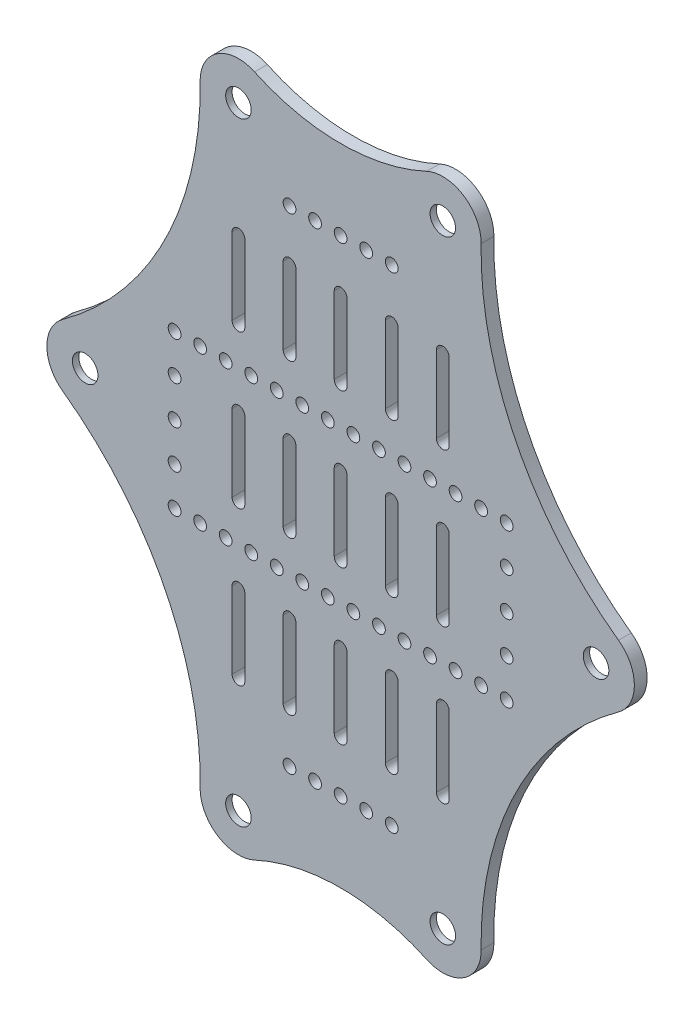
from build123d import *

# Parameters (mm, degrees)
BOSS_EXTRUDE1_DEPTH = 5
SKETCH2_R           = 5
CUT_EXTRUDE1_DEPTH  = 178.411949992
SKETCH5_R           = 2.5
CUT_EXTRUDE4_DEPTH  = 12.5
CUT_EXTRUDE5_DEPTH  = 10
SKETCH7_R           = 2.5
CUT_EXTRUDE6_DEPTH  = 10
SKETCH8_R           = 2.5
CUT_EXTRUDE7_DEPTH  = 10
SKETCH9_R           = 8.75
CUT_EXTRUDE8_DEPTH  = 2.5


with BuildPart() as part:
    # Sketch1 → Boss-Extrude1 (new body)
    with BuildSketch(Plane.XY):
        with BuildLine():
            ThreePointArc((108.79085436, -12.15404787), (115, 0), (108.79085436, 12.15404787))
            ThreePointArc((108.79085436, 12.15404787), (68.702723984, 59.351361992), (54.997750912, 119.740254766))
            ThreePointArc((54.997750912, 119.740254766), (48.179588548, 132.573556823), (33.684210526, 133.60554311))
            ThreePointArc((33.684210526, 133.60554311), (0, 126.168439698), (-33.684210526, 133.60554311))
            ThreePointArc((-33.684210526, 133.60554311), (-48.179588548, 132.573556823), (-54.997750912, 119.740254766))
            ThreePointArc((-54.997750912, 119.740254766), (-68.702723984, 59.351361992), (-108.79085436, 12.15404787))
            ThreePointArc((-108.79085436, 12.15404787), (-115, 0), (-108.79085436, -12.15404787))
            ThreePointArc((-108.79085436, -12.15404787), (-68.702723984, -59.351361992), (-54.997750912, -119.740254766))
            ThreePointArc((-54.997750912, -119.740254766), (-48.179588548, -132.573556823), (-33.684210526, -133.60554311))
            ThreePointArc((-33.684210526, -133.60554311), (0, -126.168439698), (33.684210526, -133.60554311))
            ThreePointArc((33.684210526, -133.60554311), (48.179588548, -132.573556823), (54.997750912, -119.740254766))
            ThreePointArc((54.997750912, -119.740254766), (68.702723984, -59.351361992), (108.79085436, -12.15404787))
        make_face()
    extrude(amount=BOSS_EXTRUDE1_DEPTH)

    # Sketch2 → Cut-Extrude1 (cut, through all)
    with BuildSketch(Plane(origin=(0, 0, 0), x_dir=(-1, 0, 0), z_dir=(0, 0, -1))):
        with Locations((-40, 120)):
            Circle(SKETCH2_R)
        with Locations((-100, 0)):
            Circle(SKETCH2_R)
        with Locations(Location((100, 0, 0), (0, 0, 180))):
            Circle(SKETCH2_R)
        with Locations(Location((40, 120, 0), (0, 0, 180))):
            Circle(SKETCH2_R)
        with Locations((40, -120)):
            Circle(SKETCH2_R)
        with Locations(Location((-40, -120, 0), (0, 0, 180))):
            Circle(SKETCH2_R)
    extrude(amount=-CUT_EXTRUDE1_DEPTH, mode=Mode.SUBTRACT)

    # Sketch5 → Cut-Extrude4 (cut)
    with BuildSketch(Plane(origin=(0, 0, 0), x_dir=(-1, 0, 0), z_dir=(0, 0, -1))):
        with Locations((20, 95)):
            Circle(SKETCH5_R)
        with Locations((0, 95)):
            Circle(SKETCH5_R)
        with Locations((10, 95)):
            Circle(SKETCH5_R)
        with Locations(Location((10, -95, 0), (0, 0, 180))):
            Circle(SKETCH5_R)
        with Locations(Location((0, -95, 0), (0, 0, 180))):
            Circle(SKETCH5_R)
        with Locations(Location((20, -95, 0), (0, 0, 180))):
            Circle(SKETCH5_R)
        with Locations(Location((-20, 95, 0), (0, 0, 180))):
            Circle(SKETCH5_R)
        with Locations(Location((-10, 95, 0), (0, 0, 180))):
            Circle(SKETCH5_R)
        with Locations((-20, -95)):
            Circle(SKETCH5_R)
        with Locations((-10, -95)):
            Circle(SKETCH5_R)
    extrude(amount=-CUT_EXTRUDE4_DEPTH, mode=Mode.SUBTRACT)

    # Sketch6 → Cut-Extrude5 (cut)
    with BuildSketch(Plane.XY.offset(5)):
        with BuildLine():
            Line((42.5, 75), (42.5, 45))
            ThreePointArc((42.5, 45), (40, 42.5), (37.5, 45))
            Line((37.5, 45), (37.5, 75))
            ThreePointArc((37.5, 75), (40, 77.5), (42.5, 75))
        make_face()
        with BuildLine():
            Line((22.5, 75), (22.5, 45))
            ThreePointArc((22.5, 45), (20, 42.5), (17.5, 45))
            Line((17.5, 45), (17.5, 75))
            ThreePointArc((17.5, 75), (20, 77.5), (22.5, 75))
        make_face()
        with BuildLine():
            Line((2.5, 75), (2.5, 45))
            ThreePointArc((2.5, 45), (0, 42.5), (-2.5, 45))
            Line((-2.5, 45), (-2.5, 75))
            ThreePointArc((-2.5, 75), (0, 77.5), (2.5, 75))
        make_face()
        with BuildLine():
            Line((-17.5, 75), (-17.5, 45))
            ThreePointArc((-17.5, 45), (-20, 42.5), (-22.5, 45))
            Line((-22.5, 45), (-22.5, 75))
            ThreePointArc((-22.5, 75), (-20, 77.5), (-17.5, 75))
        make_face()
        with BuildLine():
            Line((-37.5, 75), (-37.5, 45))
            ThreePointArc((-37.5, 45), (-40, 42.5), (-42.5, 45))
            Line((-42.5, 45), (-42.5, 75))
            ThreePointArc((-42.5, 75), (-40, 77.5), (-37.5, 75))
        make_face()
        with BuildLine():
            Line((42.5, 15), (42.5, -15))
            ThreePointArc((42.5, -15), (40, -17.5), (37.5, -15))
            Line((37.5, -15), (37.5, 15))
            ThreePointArc((37.5, 15), (40, 17.5), (42.5, 15))
        make_face()
        with BuildLine():
            Line((22.5, 15), (22.5, -15))
            ThreePointArc((22.5, -15), (20, -17.5), (17.5, -15))
            Line((17.5, -15), (17.5, 15))
            ThreePointArc((17.5, 15), (20, 17.5), (22.5, 15))
        make_face()
        with BuildLine():
            Line((2.5, 15), (2.5, -15))
            ThreePointArc((2.5, -15), (0, -17.5), (-2.5, -15))
            Line((-2.5, -15), (-2.5, 15))
            ThreePointArc((-2.5, 15), (0, 17.5), (2.5, 15))
        make_face()
        with BuildLine():
            Line((-17.5, 15), (-17.5, -15))
            ThreePointArc((-17.5, -15), (-20, -17.5), (-22.5, -15))
            Line((-22.5, -15), (-22.5, 15))
            ThreePointArc((-22.5, 15), (-20, 17.5), (-17.5, 15))
        make_face()
        with BuildLine():
            Line((-37.5, 15), (-37.5, -15))
            ThreePointArc((-37.5, -15), (-40, -17.5), (-42.5, -15))
            Line((-42.5, -15), (-42.5, 15))
            ThreePointArc((-42.5, 15), (-40, 17.5), (-37.5, 15))
        make_face()
        with BuildLine():
            Line((42.5, -45), (42.5, -75))
            ThreePointArc((42.5, -75), (40, -77.5), (37.5, -75))
            Line((37.5, -75), (37.5, -45))
            ThreePointArc((37.5, -45), (40, -42.5), (42.5, -45))
        make_face()
        with BuildLine():
            Line((22.5, -45), (22.5, -75))
            ThreePointArc((22.5, -75), (20, -77.5), (17.5, -75))
            Line((17.5, -75), (17.5, -45))
            ThreePointArc((17.5, -45), (20, -42.5), (22.5, -45))
        make_face()
        with BuildLine():
            Line((2.5, -45), (2.5, -75))
            ThreePointArc((2.5, -75), (0, -77.5), (-2.5, -75))
            Line((-2.5, -75), (-2.5, -45))
            ThreePointArc((-2.5, -45), (0, -42.5), (2.5, -45))
        make_face()
        with BuildLine():
            Line((-17.5, -45), (-17.5, -75))
            ThreePointArc((-17.5, -75), (-20, -77.5), (-22.5, -75))
            Line((-22.5, -75), (-22.5, -45))
            ThreePointArc((-22.5, -45), (-20, -42.5), (-17.5, -45))
        make_face()
        with BuildLine():
            Line((-37.5, -45), (-37.5, -75))
            ThreePointArc((-37.5, -75), (-40, -77.5), (-42.5, -75))
            Line((-42.5, -75), (-42.5, -45))
            ThreePointArc((-42.5, -45), (-40, -42.5), (-37.5, -45))
        make_face()
    extrude(amount=-CUT_EXTRUDE5_DEPTH, mode=Mode.SUBTRACT)

    # Sketch7 → Cut-Extrude6 (cut)
    with BuildSketch(Plane.XY.offset(5)):
        with Locations((-65, 30)):
            Circle(SKETCH7_R)
        with Locations((-55, 30)):
            Circle(SKETCH7_R)
        with Locations((-45, 30)):
            Circle(SKETCH7_R)
        with Locations((-35, 30)):
            Circle(SKETCH7_R)
        with Locations((-25, 30)):
            Circle(SKETCH7_R)
        with Locations((-15, 30)):
            Circle(SKETCH7_R)
        with Locations((-5, 30)):
            Circle(SKETCH7_R)
        with Locations((5, 30)):
            Circle(SKETCH7_R)
        with Locations((15, 30)):
            Circle(SKETCH7_R)
        with Locations((25, 30)):
            Circle(SKETCH7_R)
        with Locations((35, 30)):
            Circle(SKETCH7_R)
        with Locations((45, 30)):
            Circle(SKETCH7_R)
        with Locations((55, 30)):
            Circle(SKETCH7_R)
        with Locations((65, 30)):
            Circle(SKETCH7_R)
        with Locations((65, -30)):
            Circle(SKETCH7_R)
        with Locations((55, -30)):
            Circle(SKETCH7_R)
        with Locations((45, -30)):
            Circle(SKETCH7_R)
        with Locations((35, -30)):
            Circle(SKETCH7_R)
        with Locations((25, -30)):
            Circle(SKETCH7_R)
        with Locations((15, -30)):
            Circle(SKETCH7_R)
        with Locations((5, -30)):
            Circle(SKETCH7_R)
        with Locations((-5, -30)):
            Circle(SKETCH7_R)
        with Locations((-15, -30)):
            Circle(SKETCH7_R)
        with Locations((-25, -30)):
            Circle(SKETCH7_R)
        with Locations((-35, -30)):
            Circle(SKETCH7_R)
        with Locations((-45, -30)):
            Circle(SKETCH7_R)
        with Locations((-55, -30)):
            Circle(SKETCH7_R)
        with Locations((-65, -30)):
            Circle(SKETCH7_R)
    extrude(amount=-CUT_EXTRUDE6_DEPTH, mode=Mode.SUBTRACT)

    # Sketch8 → Cut-Extrude7 (cut)
    with BuildSketch(Plane.XY.offset(5)):
        with Locations((-65, 0)):
            Circle(SKETCH8_R)
        with Locations((-65, 15)):
            Circle(SKETCH8_R)
        with Locations((-65, -15)):
            Circle(SKETCH8_R)
        with Locations((65, -15)):
            Circle(SKETCH8_R)
        with Locations((65, 0)):
            Circle(SKETCH8_R)
        with Locations((65, 15)):
            Circle(SKETCH8_R)
    extrude(amount=-CUT_EXTRUDE7_DEPTH, mode=Mode.SUBTRACT)

    # Sketch9 → Cut-Extrude8 (cut)
    with BuildSketch(Plane(origin=(0, 0, 0), x_dir=(-1, 0, 0), z_dir=(0, 0, -1))):
        with Locations((100, 0)):
            Circle(SKETCH9_R)
        with Locations((40, 120)):
            Circle(SKETCH9_R)
        with Locations((40, -120)):
            Circle(SKETCH9_R)
        with Locations((-40, -120)):
            Circle(SKETCH9_R)
        with Locations((-100, 0)):
            Circle(SKETCH9_R)
        with Locations((-40, 120)):
            Circle(SKETCH9_R)
    extrude(amount=-CUT_EXTRUDE8_DEPTH, mode=Mode.SUBTRACT)


solid = part.part
